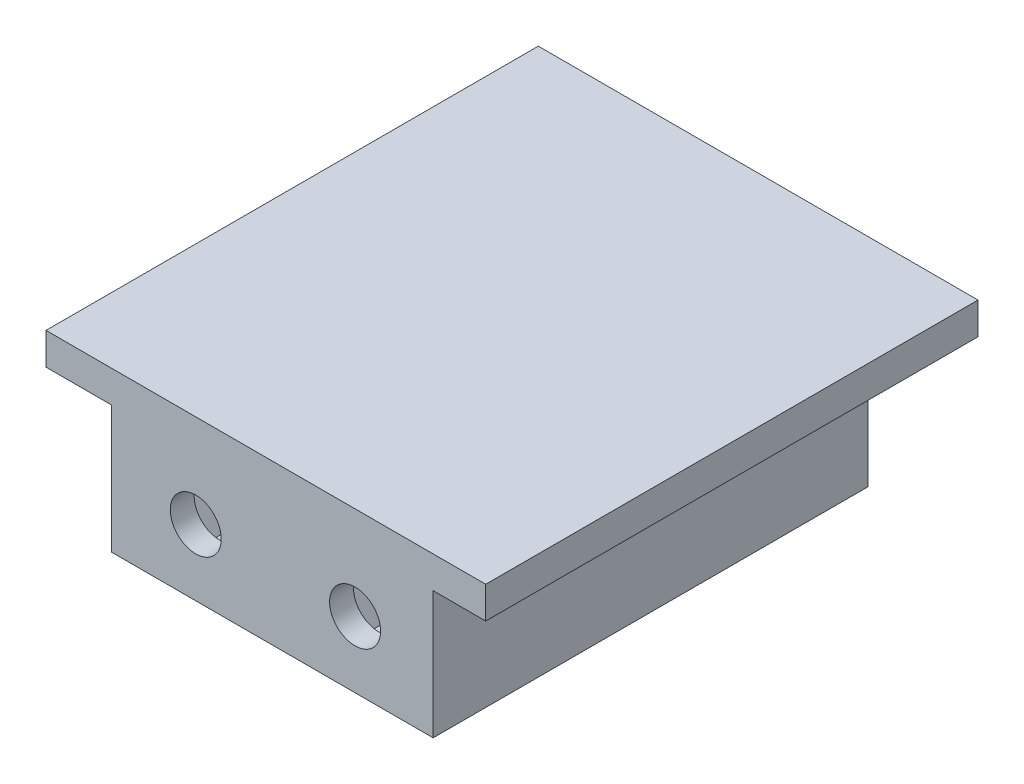
from build123d import *

# Parameters (mm, degrees)
SKETCH1_W           = 27.6
SKETCH1_H           = 30.9
BOSS_EXTRUDE1_DEPTH = 2
SKETCH2_W           = 20.2
SKETCH2_H           = 27.3
BOSS_EXTRUDE2_DEPTH = 8
SKETCH3_R           = 1.6
CUT_EXTRUDE1_DEPTH  = 32
CUT_EXTRUDE2_DEPTH  = 2.5
CUT_EXTRUDE3_DEPTH  = 2.5


with BuildPart() as part:
    # Sketch1 → Boss-Extrude1 (new body)
    with BuildSketch(Plane(origin=(0, 0, 0), x_dir=(1, 0, 0), z_dir=(0, 1, 0))):
        with Locations((25.658887851, 1.636558914)):
            Rectangle(SKETCH1_W, SKETCH1_H)
    extrude(amount=BOSS_EXTRUDE1_DEPTH)

    # Sketch2 → Boss-Extrude2 (add)
    with BuildSketch(Plane.XZ):
        with Locations((26.058887851, 0.163441086)):
            Rectangle(SKETCH2_W, SKETCH2_H)
    extrude(amount=BOSS_EXTRUDE2_DEPTH)

    # Sketch3 → Cut-Extrude1 (cut)
    with BuildSketch(Plane.XY.offset(13.813441086)):
        with Locations((21.258887851, -3.85)):
            Circle(SKETCH3_R)
        with Locations((31.258887851, -3.85)):
            Circle(SKETCH3_R)
    extrude(amount=-CUT_EXTRUDE1_DEPTH, mode=Mode.SUBTRACT)

    # Sketch4 → Cut-Extrude2 (cut)
    with BuildSketch(Plane.XY.offset(12.313441086)):
        Polygon((32.990938659, -6.85), (34.722989466, -3.85), (32.990938659, -0.85), (29.526837044, -0.85), (27.794786236, -3.85), (29.526837044, -6.85), align=None)
        Polygon((23.038641707, -6.821948218), (24.722547435, -3.794662058), (22.942793579, -0.822713839), (19.479133995, -0.878051782), (17.795228267, -3.905337942), (19.574982123, -6.877286161), align=None)
    extrude(amount=-CUT_EXTRUDE2_DEPTH, mode=Mode.SUBTRACT)

    # Sketch5 → Cut-Extrude3 (cut)
    with BuildSketch(Plane(origin=(0, 0, -11.986558914), x_dir=(-1, 0, 0), z_dir=(0, 0, -1))):
        Polygon((-29.526837044, -6.85), (-27.794786236, -3.85), (-29.526837044, -0.85), (-32.990938659, -0.85), (-34.722989466, -3.85), (-32.990938659, -6.85), align=None)
        Polygon((-19.526837044, -6.85), (-17.794786236, -3.85), (-19.526837044, -0.85), (-22.990938659, -0.85), (-24.722989466, -3.85), (-22.990938659, -6.85), align=None)
    extrude(amount=-CUT_EXTRUDE3_DEPTH, mode=Mode.SUBTRACT)


solid = part.part
